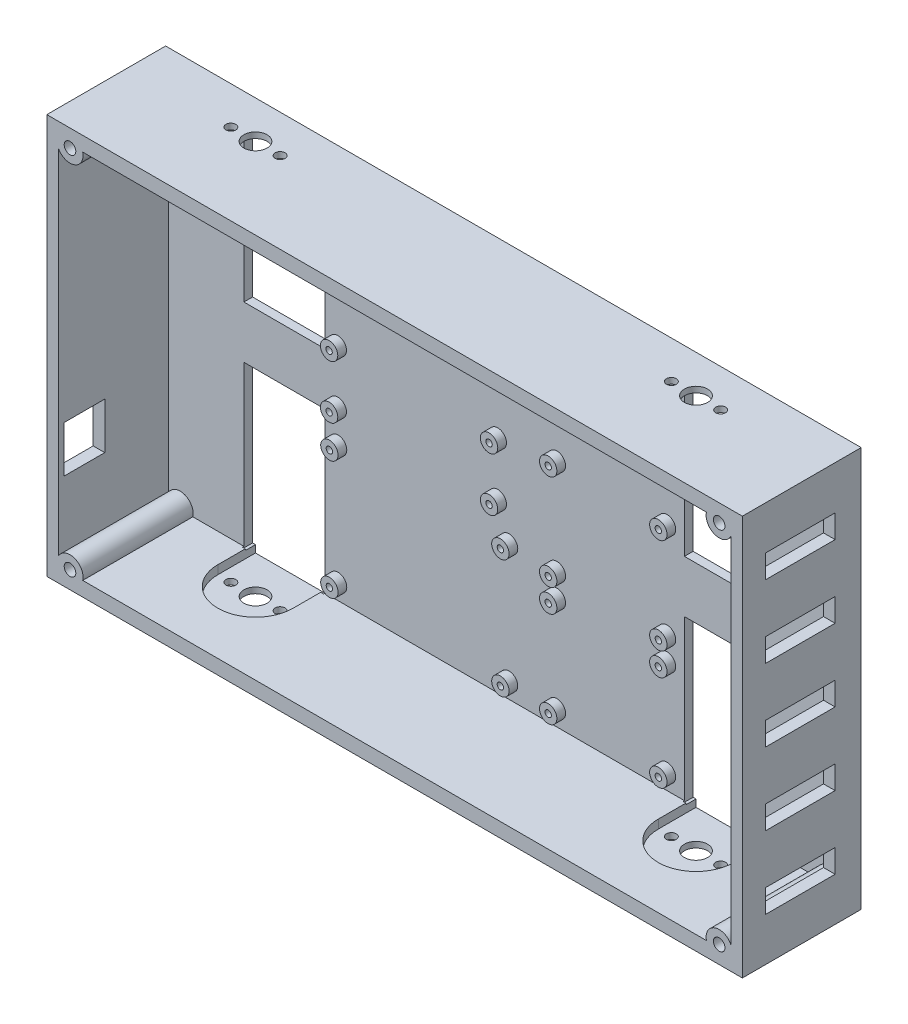
from build123d import *

# Parameters (mm, degrees)
SKETCH1_W                           = 240
SKETCH1_H                           = 138
FLOOR_2_DEPTH                       = 3
SKETCH2_W                           = 240
SKETCH2_H                           = 138
SKETCH2_W_2                         = 232
SKETCH2_H_2                         = 128
WALLS_DEPTH                         = 38
SKETCH3_R                           = 4.5
INSERT_COLUMNS_DEPTH                = 38
SKETCH4_R                           = 3
BOARD_STANDOFFS_DEPTH               = 3
SKETCH5_R                           = 1.1
STANDOFF_PILOTS_DEPTH               = 5
SKETCH6_W                           = 28
SKETCH6_H                           = 55.5
MOTOR_FLOOR_WINDOWS_DEPTH           = 4.5
MOTOR_POCKET_L_DEPTH                = 3
MOTOR_POCKET_R_DEPTH                = 3
MOTOR_SHAFT_AND_M3_HOLES_DEPTH      = 170.602476397
MOTOR_SHAFT_AND_M3_HOLES_DEPTH_BACK = 170.602476397
SKETCH9_R                           = 4
SKETCH9_R_2                         = 1.7
SKETCH10_R                          = 2
M3_INSERT_BORES_DEPTH               = 8
SKETCH11_R                          = 1.7
CRADLE_M3_HOLES_DEPTH               = 5
SKETCH12_W                          = 14
SKETCH12_H                          = 16
USB_GROMMET_DEPTH                   = 6
SKETCH13_W                          = 24
SKETCH13_H                          = 8
VENT_SLOTS_DEPTH                    = 6


with BuildPart() as part:
    # Sketch1 → Floor 2 (new body)
    with BuildSketch(Plane.XY.offset(57)):
        Rectangle(SKETCH1_W, SKETCH1_H)
    extrude(amount=FLOOR_2_DEPTH)

    # Sketch2 → Walls (add)
    with BuildSketch(Plane.XY.offset(60)):
        Rectangle(SKETCH2_W, SKETCH2_H)
        Rectangle(SKETCH2_W_2, SKETCH2_H_2, mode=Mode.SUBTRACT)
    extrude(amount=WALLS_DEPTH)

    # Sketch3 → Insert_columns (add)
    with BuildSketch(Plane.XY.offset(60)):
        with Locations((-112, 63)):
            Circle(SKETCH3_R)
        with Locations((-112, -63)):
            Circle(SKETCH3_R)
        with Locations((112, 63)):
            Circle(SKETCH3_R)
        with Locations((112, -63)):
            Circle(SKETCH3_R)
    extrude(amount=INSERT_COLUMNS_DEPTH)

    # Sketch4 → Board_standoffs (add)
    with BuildSketch(Plane.XY.offset(60)):
        with Locations((1.5, -17.5)):
            Circle(SKETCH4_R)
        with Locations((1.5, -58.5)):
            Circle(SKETCH4_R)
        with Locations((-57.5, -17.5)):
            Circle(SKETCH4_R)
        with Locations((-57.5, -58.5)):
            Circle(SKETCH4_R)
        with Locations((56, -25.5)):
            Circle(SKETCH4_R)
        with Locations((56, -58.5)):
            Circle(SKETCH4_R)
        with Locations((18, -25.5)):
            Circle(SKETCH4_R)
        with Locations((18, -58.5)):
            Circle(SKETCH4_R)
        with Locations((56, 15.5)):
            Circle(SKETCH4_R)
        with Locations((56, -17.5)):
            Circle(SKETCH4_R)
        with Locations((18, 15.5)):
            Circle(SKETCH4_R)
        with Locations((18, -17.5)):
            Circle(SKETCH4_R)
        with Locations((-2.4, 12.2)):
            Circle(SKETCH4_R)
        with Locations((-2.4, -6.2)):
            Circle(SKETCH4_R)
        with Locations((-57.6, 12.2)):
            Circle(SKETCH4_R)
        with Locations((-57.6, -6.2)):
            Circle(SKETCH4_R)
        with Locations((-107, 47.5)):
            Circle(SKETCH4_R)
        with Locations((-97, 47.5)):
            Circle(SKETCH4_R)
        with Locations((-107, 32.5)):
            Circle(SKETCH4_R)
        with Locations((-97, 32.5)):
            Circle(SKETCH4_R)
    extrude(amount=BOARD_STANDOFFS_DEPTH)

    # Sketch5 → Standoff_pilots (cut)
    with BuildSketch(Plane.XY.offset(59)):
        with Locations((1.5, -17.5)):
            Circle(SKETCH5_R)
        with Locations((1.5, -58.5)):
            Circle(SKETCH5_R)
        with Locations((-57.5, -17.5)):
            Circle(SKETCH5_R)
        with Locations((-57.5, -58.5)):
            Circle(SKETCH5_R)
        with Locations((56, -25.5)):
            Circle(SKETCH5_R)
        with Locations((56, -58.5)):
            Circle(SKETCH5_R)
        with Locations((18, -25.5)):
            Circle(SKETCH5_R)
        with Locations((18, -58.5)):
            Circle(SKETCH5_R)
        with Locations((56, 15.5)):
            Circle(SKETCH5_R)
        with Locations((56, -17.5)):
            Circle(SKETCH5_R)
        with Locations((18, 15.5)):
            Circle(SKETCH5_R)
        with Locations((18, -17.5)):
            Circle(SKETCH5_R)
        with Locations((-2.4, 12.2)):
            Circle(SKETCH5_R)
        with Locations((-2.4, -6.2)):
            Circle(SKETCH5_R)
        with Locations((-57.6, 12.2)):
            Circle(SKETCH5_R)
        with Locations((-57.6, -6.2)):
            Circle(SKETCH5_R)
        with Locations((-107, 47.5)):
            Circle(SKETCH5_R)
        with Locations((-97, 47.5)):
            Circle(SKETCH5_R)
        with Locations((-107, 32.5)):
            Circle(SKETCH5_R)
        with Locations((-97, 32.5)):
            Circle(SKETCH5_R)
    extrude(amount=STANDOFF_PILOTS_DEPTH, mode=Mode.SUBTRACT)

    # Sketch6 → Motor_floor_windows (cut)
    with BuildSketch(Plane.XY.offset(56)):
        with Locations((76, 36.75)):
            Rectangle(SKETCH6_W, SKETCH6_H)
        with Locations((76, -36.75)):
            Rectangle(SKETCH6_W, SKETCH6_H)
        with Locations((-76, 36.75)):
            Rectangle(SKETCH6_W, SKETCH6_H)
        with Locations((-76, -36.75)):
            Rectangle(SKETCH6_W, SKETCH6_H)
    extrude(amount=MOTOR_FLOOR_WINDOWS_DEPTH, mode=Mode.SUBTRACT)

    # Sketch7 → Motor_pocket_L (cut)
    with BuildSketch(Plane(origin=(0, 64, 0), x_dir=(1, 0, 0), z_dir=(0, 1, 0))):
        with BuildLine():
            Line((89, -70), (89, -52))
            Line((89, -52), (63, -52))
            Line((63, -52), (63, -70))
            ThreePointArc((63, -70), (76, -83), (89, -70))
        make_face()
        with BuildLine():
            Line((-63, -70), (-63, -52))
            Line((-63, -52), (-89, -52))
            Line((-89, -52), (-89, -70))
            ThreePointArc((-89, -70), (-76, -83), (-63, -70))
        make_face()
    extrude(amount=MOTOR_POCKET_L_DEPTH, mode=Mode.SUBTRACT)

    # Sketch8 → Motor_pocket_R (cut)
    with BuildSketch(Plane(origin=(0, -67, 0), x_dir=(1, 0, 0), z_dir=(0, 1, 0))):
        with BuildLine():
            Line((89, -70), (89, -52))
            Line((89, -52), (63, -52))
            Line((63, -52), (63, -70))
            ThreePointArc((63, -70), (76, -83), (89, -70))
        make_face()
        with BuildLine():
            Line((-63, -70), (-63, -52))
            Line((-63, -52), (-89, -52))
            Line((-89, -52), (-89, -70))
            ThreePointArc((-89, -70), (-76, -83), (-63, -70))
        make_face()
    extrude(amount=MOTOR_POCKET_R_DEPTH, mode=Mode.SUBTRACT)

    # Sketch9 → Motor_shaft_and_M3_holes (cut, two sides: drawn at the far end of the back side and taken through both)
    with BuildSketch(Plane(origin=(0, 0, 0), x_dir=(1, 0, 0), z_dir=(0, 1, 0)).offset(-MOTOR_SHAFT_AND_M3_HOLES_DEPTH_BACK)):
        with Locations(Location((76, -70, 0), (0, 0, 270))):
            Circle(SKETCH9_R)
        with Locations(Location((67.5, -70, 0), (0, 0, 270))):
            Circle(SKETCH9_R_2)
        with Locations(Location((84.5, -70, 0), (0, 0, 270))):
            Circle(SKETCH9_R_2)
        with Locations(Location((-76, -70, 0), (0, 0, 270))):
            Circle(SKETCH9_R)
        with Locations(Location((-84.5, -70, 0), (0, 0, 270))):
            Circle(SKETCH9_R_2)
        with Locations(Location((-67.5, -70, 0), (0, 0, 270))):
            Circle(SKETCH9_R_2)
    extrude(amount=MOTOR_SHAFT_AND_M3_HOLES_DEPTH + MOTOR_SHAFT_AND_M3_HOLES_DEPTH_BACK, mode=Mode.SUBTRACT)

    # Sketch10 → M3_insert_bores (cut)
    with BuildSketch(Plane.XY.offset(98)):
        with Locations((-112, 63)):
            Circle(SKETCH10_R)
        with Locations((-112, -63)):
            Circle(SKETCH10_R)
        with Locations((112, 63)):
            Circle(SKETCH10_R)
        with Locations((112, -63)):
            Circle(SKETCH10_R)
    extrude(amount=-M3_INSERT_BORES_DEPTH, mode=Mode.SUBTRACT)

    # Sketch11 → Cradle_M3_holes (cut)
    with BuildSketch(Plane.XY.offset(56)):
        with Locations((61, 42)):
            Circle(SKETCH11_R)
        with Locations((-61, 42)):
            Circle(SKETCH11_R)
    extrude(amount=CRADLE_M3_HOLES_DEPTH, mode=Mode.SUBTRACT)

    # Sketch12 → USB_grommet (cut)
    with BuildSketch(Plane(origin=(-121, 0, 0), x_dir=(0, 0, -1), z_dir=(1, 0, 0))):
        with Locations((-89, -30)):
            Rectangle(SKETCH12_W, SKETCH12_H)
    extrude(amount=USB_GROMMET_DEPTH, mode=Mode.SUBTRACT)

    # Sketch13 → Vent_slots (cut)
    with BuildSketch(Plane(origin=(115, 0, 0), x_dir=(0, 0, -1), z_dir=(1, 0, 0))):
        with Locations((-78, -50)):
            Rectangle(SKETCH13_W, SKETCH13_H)
        with Locations((-78, -25)):
            Rectangle(SKETCH13_W, SKETCH13_H)
        with Locations((-78, 0)):
            Rectangle(SKETCH13_W, SKETCH13_H)
        with Locations((-78, 25)):
            Rectangle(SKETCH13_W, SKETCH13_H)
        with Locations((-78, 50)):
            Rectangle(SKETCH13_W, SKETCH13_H)
    extrude(amount=VENT_SLOTS_DEPTH, mode=Mode.SUBTRACT)


solid = part.part
